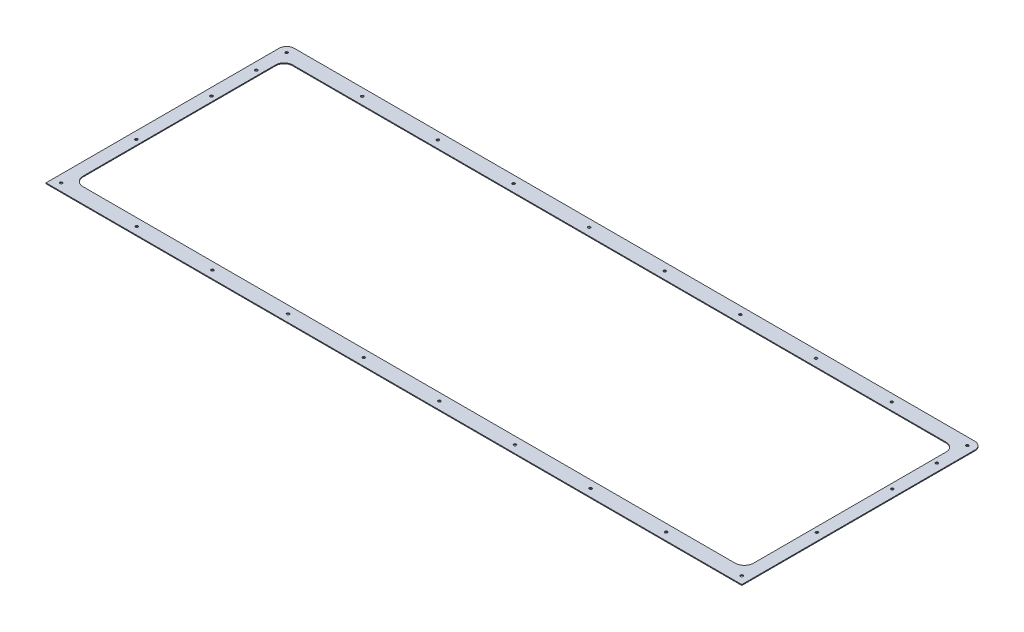
from build123d import *

# Parameters (mm, degrees)
SZKIC4_R                    = 1.55
DODANIE_WYCI_GNI_CIE1_DEPTH = 1


with BuildPart() as part:
    # Szkic4 → Dodanie-wyciągnięcie1 (new body)
    with BuildSketch(Plane(origin=(0, 1505.947389818, 0), x_dir=(1, 0, 0), z_dir=(0, 1, 0))):
        with BuildLine():
            Line((11370.979687398, -709.37446721), (12194.979687398, -709.37446721))
            Line((12194.979687398, -709.37446721), (12194.979687398, -433.37446721))
            ThreePointArc((12194.979687398, -433.37446721), (12192.343648428, -427.010506179), (12185.979687398, -424.37446721))
            Line((12185.979687398, -424.37446721), (11379.979687398, -424.37446721))
            ThreePointArc((11379.979687398, -424.37446721), (11373.615726367, -427.010506179), (11370.979687398, -433.37446721))
            Line((11370.979687398, -433.37446721), (11370.979687398, -709.37446721))
        make_face()
        with Locations(Location((11379.979687398, -433.37446721, 0), (0, 0, 269.999999998))):
            Circle(SZKIC4_R, mode=Mode.SUBTRACT)
        with Locations(Location((11469.539687398, -433.37446721, 0), (0, 0, 269.999999998))):
            Circle(SZKIC4_R, mode=Mode.SUBTRACT)
        with Locations(Location((11559.094687398, -433.37446721, 0), (0, 0, 269.999999998))):
            Circle(SZKIC4_R, mode=Mode.SUBTRACT)
        with Locations(Location((11648.649687398, -433.37446721, 0), (0, 0, 269.999999998))):
            Circle(SZKIC4_R, mode=Mode.SUBTRACT)
        with Locations(Location((11738.204687398, -433.37446721, 0), (0, 0, 269.999999998))):
            Circle(SZKIC4_R, mode=Mode.SUBTRACT)
        with Locations(Location((11827.759687398, -433.37446721, 0), (0, 0, 269.999999998))):
            Circle(SZKIC4_R, mode=Mode.SUBTRACT)
        with Locations(Location((11917.314687398, -433.37446721, 0), (0, 0, 269.999999998))):
            Circle(SZKIC4_R, mode=Mode.SUBTRACT)
        with Locations(Location((12006.869687398, -433.37446721, 0), (0, 0, 269.999999998))):
            Circle(SZKIC4_R, mode=Mode.SUBTRACT)
        with Locations(Location((12096.424687398, -433.37446721, 0), (0, 0, 269.999999998))):
            Circle(SZKIC4_R, mode=Mode.SUBTRACT)
        with Locations(Location((12185.979687398, -433.37446721, 0), (0, 0, 269.999999998))):
            Circle(SZKIC4_R, mode=Mode.SUBTRACT)
        with Locations(Location((12185.979687398, -469.37446721, 0), (0, 0, 269.999999998))):
            Circle(SZKIC4_R, mode=Mode.SUBTRACT)
        with Locations(Location((12185.979687398, -522.37446721, 0), (0, 0, 269.999999998))):
            Circle(SZKIC4_R, mode=Mode.SUBTRACT)
        with Locations(Location((12185.979687398, -611.37446721, 0), (0, 0, 269.999999998))):
            Circle(SZKIC4_R, mode=Mode.SUBTRACT)
        with Locations(Location((12185.979687398, -700.37446721, 0), (0, 0, 269.999999998))):
            Circle(SZKIC4_R, mode=Mode.SUBTRACT)
        with Locations(Location((12096.419687398, -700.37446721, 0), (0, 0, 269.999999998))):
            Circle(SZKIC4_R, mode=Mode.SUBTRACT)
        with Locations(Location((12006.864687398, -700.37446721, 0), (0, 0, 269.999999998))):
            Circle(SZKIC4_R, mode=Mode.SUBTRACT)
        with Locations(Location((11917.309687398, -700.37446721, 0), (0, 0, 269.999999998))):
            Circle(SZKIC4_R, mode=Mode.SUBTRACT)
        with Locations(Location((11827.754687398, -700.37446721, 0), (0, 0, 269.999999998))):
            Circle(SZKIC4_R, mode=Mode.SUBTRACT)
        with Locations(Location((11738.199687398, -700.37446721, 0), (0, 0, 269.999999998))):
            Circle(SZKIC4_R, mode=Mode.SUBTRACT)
        with Locations(Location((11648.644687398, -700.37446721, 0), (0, 0, 269.999999998))):
            Circle(SZKIC4_R, mode=Mode.SUBTRACT)
        with Locations(Location((11559.089687398, -700.37446721, 0), (0, 0, 269.999999998))):
            Circle(SZKIC4_R, mode=Mode.SUBTRACT)
        with Locations(Location((11469.534687398, -700.37446721, 0), (0, 0, 269.999999998))):
            Circle(SZKIC4_R, mode=Mode.SUBTRACT)
        with Locations(Location((11379.979687398, -700.37446721, 0), (0, 0, 269.999999998))):
            Circle(SZKIC4_R, mode=Mode.SUBTRACT)
        with Locations(Location((11379.979687398, -611.37446721, 0), (0, 0, 269.999999998))):
            Circle(SZKIC4_R, mode=Mode.SUBTRACT)
        with Locations(Location((11379.979687398, -522.37446721, 0), (0, 0, 269.999999998))):
            Circle(SZKIC4_R, mode=Mode.SUBTRACT)
        with Locations(Location((11379.979687398, -469.37446721, 0), (0, 0, 269.999999998))):
            Circle(SZKIC4_R, mode=Mode.SUBTRACT)
        with BuildLine():
            Line((11385.979687398, -452.37446721), (11385.979687398, -680.37446721))
            ThreePointArc((11385.979687398, -680.37446721), (11389.201512805, -688.152641803), (11396.979687398, -691.37446721))
            Line((11396.979687398, -691.37446721), (12168.979687398, -691.37446721))
            ThreePointArc((12168.979687398, -691.37446721), (12176.757861991, -688.152641803), (12179.979687398, -680.37446721))
            Line((12179.979687398, -680.37446721), (12179.979687398, -452.37446721))
            ThreePointArc((12179.979687398, -452.37446721), (12177.05075521, -445.303399398), (12169.979687398, -442.37446721))
            Line((12169.979687398, -442.37446721), (11395.979687398, -442.37446721))
            ThreePointArc((11395.979687398, -442.37446721), (11388.908619586, -445.303399398), (11385.979687398, -452.37446721))
        make_face(mode=Mode.SUBTRACT)
    extrude(amount=DODANIE_WYCI_GNI_CIE1_DEPTH)


solid = part.part
